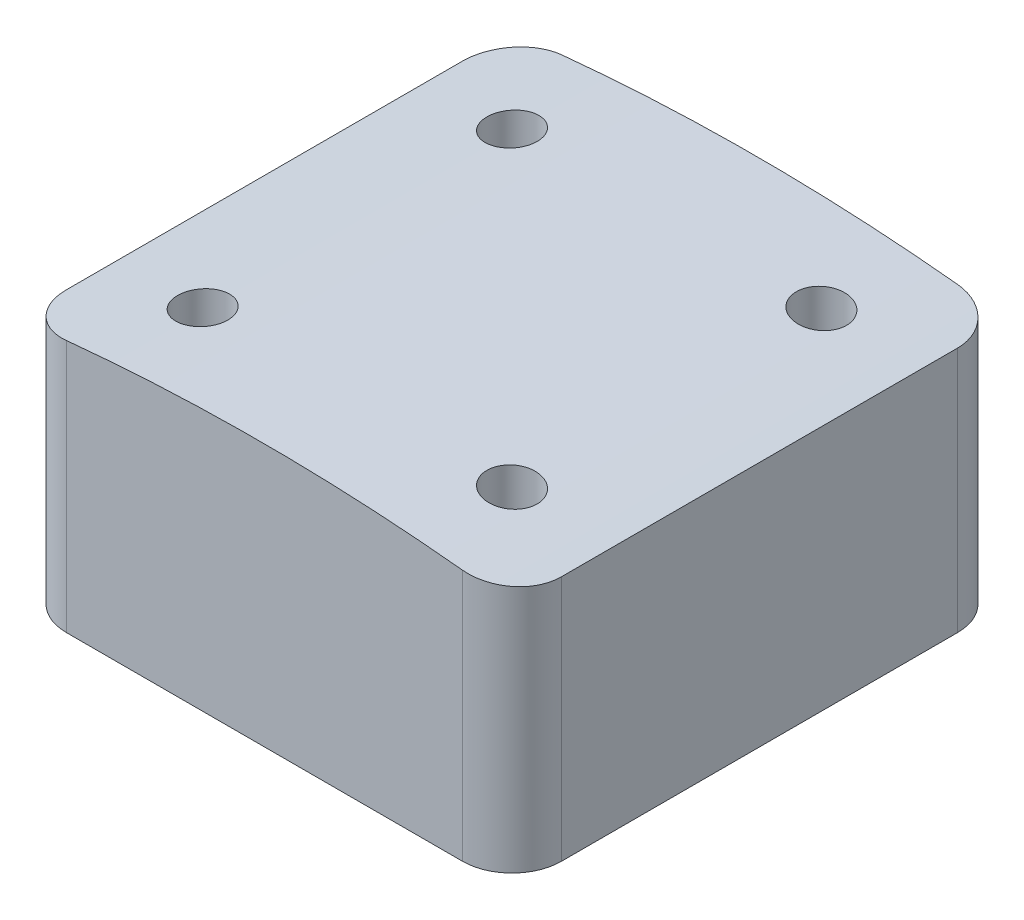
from build123d import *

# Parameters (mm, degrees)
BOSS_EXTRUDE1_DEPTH             = 12.7
BOSS_EXTRUDE1_DEPTH_BACK        = 12.7
TAP_DRILL_FOR_3_8_16_TAP1_D     = 7.9375
TAP_DRILL_FOR_3_8_16_TAP1_DEPTH = 9.525
TAP_DRILL_FOR_3_8_16_TAP1_TIP   = 2.384665582
F_5_40_TAPPED_HOLE1_D           = 2.5781
FILLET1_R                       = 2.54


with BuildPart() as part:
    # Sketch1 → Boss-Extrude1 (new, two sides: drawn at the far end of the back side and taken through both)
    with BuildSketch(Plane.XY.offset(-BOSS_EXTRUDE1_DEPTH_BACK)):
        with BuildLine():
            Line((-12.701329683, 100.803292467), (-12.701329683, 88.103292467))
            Line((-12.701329683, 88.103292467), (12.698670317, 88.103292467))
            Line((12.698670317, 88.103292467), (12.698670317, 100.749441262))
            ThreePointArc((12.698670317, 100.749441262), (0.000359797, 101.573243718), (-12.701329683, 100.803292467))
        make_face()
    extrude(amount=BOSS_EXTRUDE1_DEPTH + BOSS_EXTRUDE1_DEPTH_BACK)

    # Tap Drill for 3/8-16 Tap1
    with Locations(Plane(origin=(0, 88.103292467, 0), x_dir=(-1, 0, 0), z_dir=(0, -1, 0))):
        with Locations((0, 0)):
            Hole(TAP_DRILL_FOR_3_8_16_TAP1_D / 2, depth=TAP_DRILL_FOR_3_8_16_TAP1_DEPTH)
            with Locations((0, 0, -(TAP_DRILL_FOR_3_8_16_TAP1_DEPTH + TAP_DRILL_FOR_3_8_16_TAP1_TIP / 2))):  # 118° drill point
                Cone(0, TAP_DRILL_FOR_3_8_16_TAP1_D / 2, TAP_DRILL_FOR_3_8_16_TAP1_TIP, mode=Mode.SUBTRACT)

    # #5-40 Tapped Hole1 (through all)
    with Locations(Plane(origin=(0, 88.103292467, 0), x_dir=(-1, 0, 0), z_dir=(0, -1, 0))):
        with Locations((-7.9375, -7.9375), (-7.9375, 7.9375), (7.9375, 7.9375), (7.9375, -7.9375)):
            Hole(F_5_40_TAPPED_HOLE1_D / 2)

    # Fillet1
    fillet1_edges = [part.edges().sort_by_distance(p)[0] for p in [
        (12.698670317, 94.426366864, 12.7),
        (-12.701329683, 94.453292467, 12.7),
        (-12.701329683, 94.453292467, -12.7),
        (12.698670317, 94.426366864, -12.7),
    ]]
    fillet(fillet1_edges, radius=FILLET1_R)


solid = part.part
